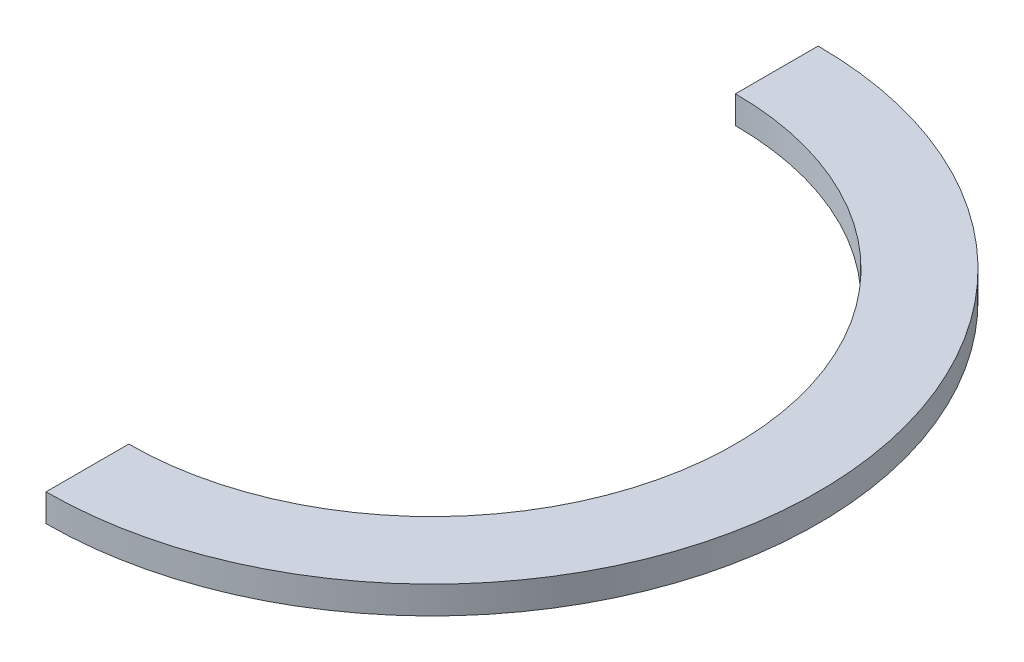
from build123d import *

# Parameters (mm, degrees)
BOSS_EXTRUDE1_DEPTH = 1


with BuildPart() as part:
    # Sketch1 → Boss-Extrude1 (new body)
    with BuildSketch(Plane(origin=(0, 0, 0), x_dir=(1, 0, 0), z_dir=(0, 1, 0))):
        with BuildLine():
            ThreePointArc((0, -14), (14, 0), (0, 14))
            Line((0, 14), (0, 11))
            ThreePointArc((0, 11), (11, 0), (0, -11))
            Line((0, -11), (0, -14))
        make_face()
    extrude(amount=BOSS_EXTRUDE1_DEPTH)


solid = part.part
